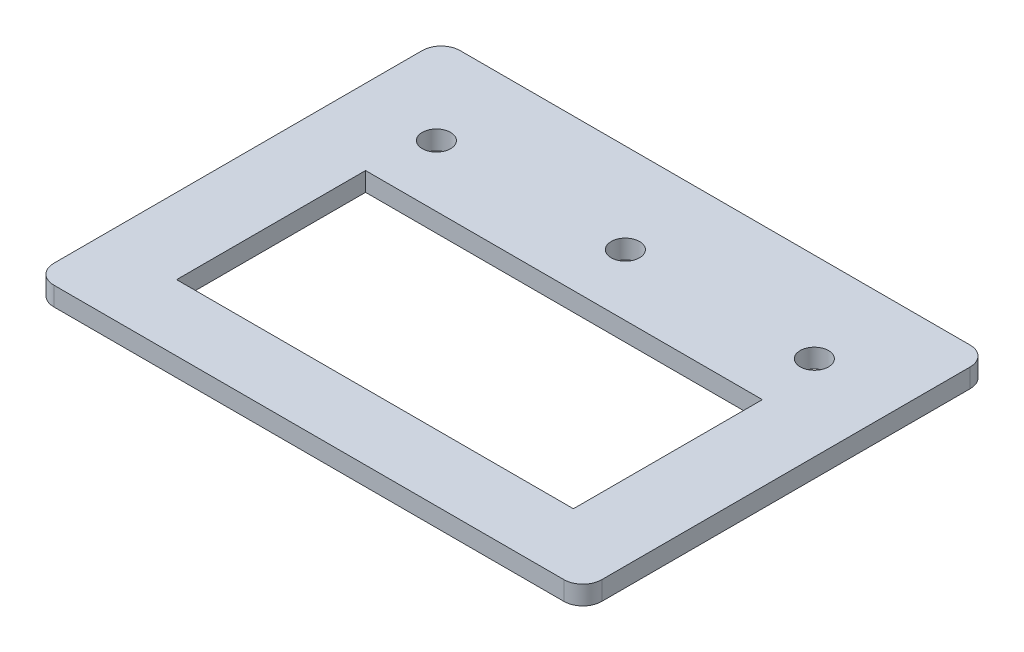
from build123d import *

# Parameters (mm, degrees)
SKETCH1_W           = 58
SKETCH1_H           = 43
SKETCH1_R           = 1.5
SKETCH1_W_2         = 42
SKETCH1_H_2         = 20
BOSS_EXTRUDE1_DEPTH = 2
FILLET1_R           = 2


with BuildPart() as part:
    # Sketch1 → Boss-Extrude1 (new body)
    with BuildSketch(Plane(origin=(0, 0, 0), x_dir=(1, 0, 0), z_dir=(0, 1, 0))):
        Rectangle(SKETCH1_W, SKETCH1_H)
        with Locations(Location((0, 12, 0), (0, 0, 270))):
            Circle(SKETCH1_R, mode=Mode.SUBTRACT)
        with Locations(Location((20, 12, 0), (0, 0, 270))):
            Circle(SKETCH1_R, mode=Mode.SUBTRACT)
        with Locations(Location((-20, 12, 0), (0, 0, 270))):
            Circle(SKETCH1_R, mode=Mode.SUBTRACT)
        with Locations((0, -4.5)):
            Rectangle(SKETCH1_W_2, SKETCH1_H_2, mode=Mode.SUBTRACT)
    extrude(amount=BOSS_EXTRUDE1_DEPTH)

    # Fillet1
    fillet1_edges = [part.edges().sort_by_distance(p)[0] for p in [
        (29, 1, 21.5),
        (-29, 1, 21.5),
        (-29, 1, -21.5),
        (29, 1, -21.5),
    ]]
    fillet(fillet1_edges, radius=FILLET1_R)


solid = part.part
